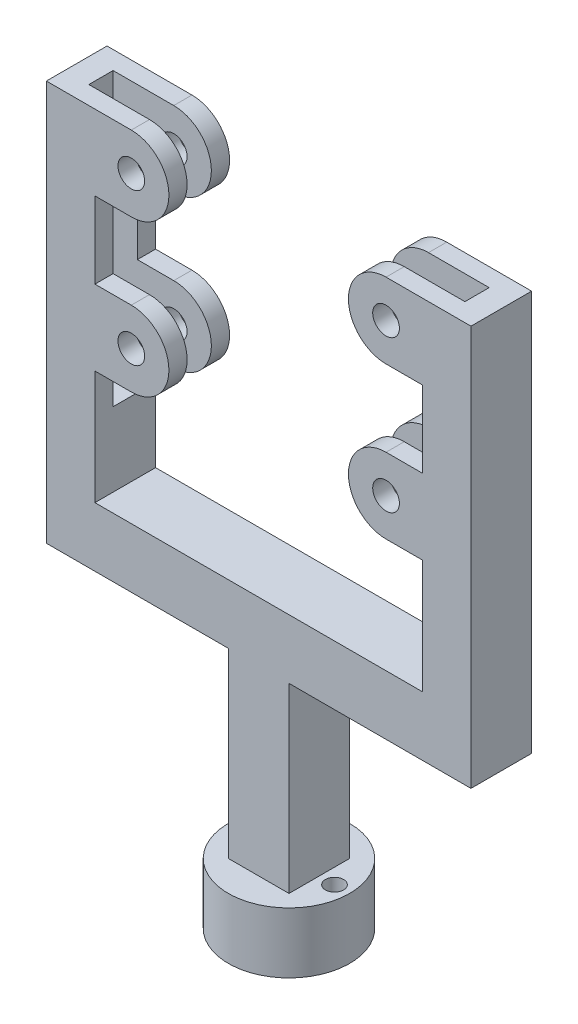
from build123d import *

# Parameters (mm, degrees)
SKETCH1_R                 = 1.1
BOSS_EXTRUDE1_DEPTH       = 5
SKETCH2_W                 = 31
SKETCH2_H                 = 2
CUT_EXTRUDE1_DEPTH        = 22
SKETCH4_R                 = 5
BOSS_EXTRUDE2_DEPTH       = 5
F_1_5MM_DOWEL_HOLE1_D     = 1.5
F_1_5MM_DOWEL_HOLE1_DEPTH = 5


with BuildPart() as part:
    # Sketch1 → Boss-Extrude1 (new body)
    with BuildSketch(Plane.XY):
        with BuildLine():
            Line((-10.5, 9.35), (-17.5, 9.35))
            Line((-17.5, 9.35), (-17.5, -23.65))
            Line((-17.5, -23.65), (-2.5, -23.65))
            Line((-2.5, -23.65), (-2.5, -38.65))
            Line((-2.5, -38.65), (2.5, -38.65))
            Line((2.5, -38.65), (2.5, -23.65))
            Line((2.5, -23.65), (17.5, -23.65))
            Line((17.5, -23.65), (17.5, 9.35))
            Line((17.5, 9.35), (10.5, 9.35))
            ThreePointArc((10.5, 9.35), (7.4, 6.25), (10.5, 3.15))
            Line((10.5, 3.15), (13.5, 3.15))
            Line((13.5, 3.15), (13.5, -3.15))
            Line((13.5, -3.15), (10.5, -3.15))
            ThreePointArc((10.5, -3.15), (7.4, -6.25), (10.5, -9.35))
            Line((10.5, -9.35), (13.5, -9.35))
            Line((13.5, -9.35), (13.5, -18.75))
            Line((13.5, -18.75), (-13.5, -18.75))
            Line((-13.5, -18.75), (-13.5, -9.35))
            Line((-13.5, -9.35), (-10.5, -9.35))
            ThreePointArc((-10.5, -9.35), (-7.4, -6.25), (-10.5, -3.15))
            Line((-10.5, -3.15), (-13.5, -3.15))
            Line((-13.5, -3.15), (-13.5, 3.15))
            Line((-13.5, 3.15), (-10.5, 3.15))
            ThreePointArc((-10.5, 3.15), (-7.4, 6.25), (-10.5, 9.35))
        make_face()
        with Locations((-10.5, 6.25)):
            Circle(SKETCH1_R, mode=Mode.SUBTRACT)
        with Locations((10.5, 6.25)):
            Circle(SKETCH1_R, mode=Mode.SUBTRACT)
        with Locations((10.5, -6.25)):
            Circle(SKETCH1_R, mode=Mode.SUBTRACT)
        with Locations((-10.5, -6.25)):
            Circle(SKETCH1_R, mode=Mode.SUBTRACT)
    extrude(amount=BOSS_EXTRUDE1_DEPTH)

    # Sketch2 → Cut-Extrude1 (cut)
    with BuildSketch(Plane(origin=(0, 9.35, 0), x_dir=(1, 0, 0), z_dir=(0, 1, 0))):
        with Locations((0, -2.5)):
            Rectangle(SKETCH2_W, SKETCH2_H)
    extrude(amount=-CUT_EXTRUDE1_DEPTH, mode=Mode.SUBTRACT)

    # Sketch4 → Boss-Extrude2 (add)
    with BuildSketch(Plane.XZ.offset(38.65)):
        with Locations(Location((0, 2.5, 0), (0, 0, 270))):
            Circle(SKETCH4_R)
    extrude(amount=BOSS_EXTRUDE2_DEPTH)

    # Ø1.5mm Dowel Hole1
    with Locations(Plane(origin=(3.75, -38.65, 2.5), x_dir=(0, 0, 1), z_dir=(0, 1, 0))):
        with Locations((0, 0), (0, -7.5)):
            Hole(F_1_5MM_DOWEL_HOLE1_D / 2, depth=F_1_5MM_DOWEL_HOLE1_DEPTH)


solid = part.part
